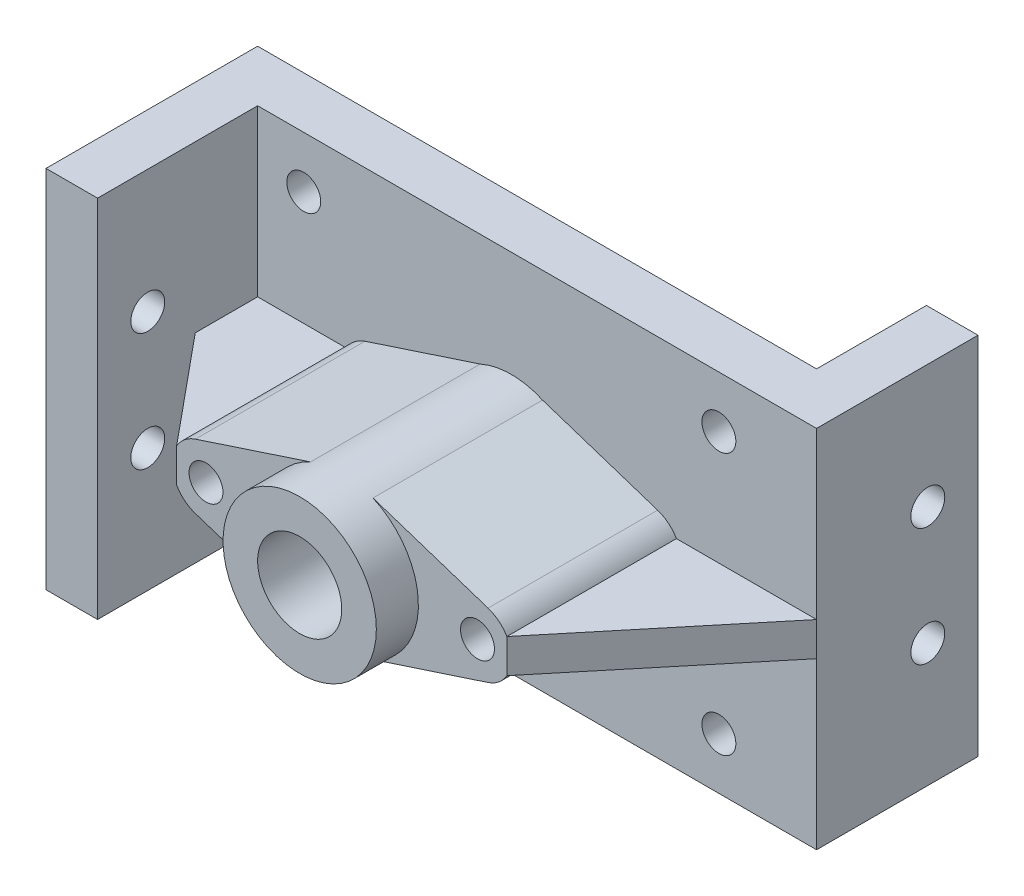
from build123d import *

# Parameters (mm, degrees)
BOSS_EXTRUDE1_DEPTH  = 2.69
SKETCH3_R            = 0.125
CUT_EXTRUDE2_DEPTH   = 10
SKETCH5_R            = 0.125
CUT_EXTRUDE4_DEPTH   = 10
SKETCH2_R            = 0.125
CUT_EXTRUDE5_DEPTH   = 10
SKETCH6_R            = 0.565
BOSS_EXTRUDE2_DEPTH  = 1.56
SKETCH8_R            = 0.31
CUT_EXTRUDE6_DEPTH   = 10
BOSS_EXTRUDE7_DEPTH  = 1.25
SKETCH22_R           = 0.125
CUT_EXTRUDE8_DEPTH   = 10
SKETCH23_R           = 0.125
CUT_EXTRUDE9_DEPTH   = 10
SKETCH25_W           = 1.099767666
SKETCH25_H           = 0.25
BOSS_EXTRUDE8_DEPTH  = 1.25
CUT_EXTRUDE13_DEPTH  = 0.25
SKETCH30_W           = 1.18
SKETCH30_H           = 0.25
BOSS_EXTRUDE10_DEPTH = 0.38


with BuildPart() as part:
    # Sketch1 → Boss-Extrude1 (new body)
    with BuildSketch(Plane(origin=(0, 0, 0), x_dir=(1, 0, 0), z_dir=(0, 1, 0))):
        Polygon((0, 0), (0, 1.56), (4.12, 1.56), (4.12, 2.37), (4.5, 2.37), (4.5, 1.18), (0.38, 1.18), (0.38, 0), align=None)
    extrude(amount=BOSS_EXTRUDE1_DEPTH)

    # Sketch3 → Cut-Extrude2 (cut)
    with BuildSketch(Plane(origin=(4.5, 0, 0), x_dir=(0, 0, -1), z_dir=(1, 0, 0))):
        with Locations((2, 1.78)):
            Circle(SKETCH3_R)
        with Locations(Location((2, 0.91, 0), (0, 0, 180))):
            Circle(SKETCH3_R)
    extrude(amount=-CUT_EXTRUDE2_DEPTH, mode=Mode.SUBTRACT)

    # Sketch5 → Cut-Extrude4 (cut)
    with BuildSketch(Plane(origin=(0.38, 0, 0), x_dir=(0, 0, -1), z_dir=(1, 0, 0))):
        with Locations((0.37, 1.78)):
            Circle(SKETCH5_R)
        with Locations(Location((0.37, 0.91, 0), (0, 0, 180))):
            Circle(SKETCH5_R)
    extrude(amount=-CUT_EXTRUDE4_DEPTH, mode=Mode.SUBTRACT)

    # Sketch2 → Cut-Extrude5 (cut)
    with BuildSketch(Plane.XY.offset(-1.18)):
        with Locations((3.78, 2.31)):
            Circle(SKETCH2_R)
        with Locations(Location((3.78, 0.38, 0), (0, 0, 180))):
            Circle(SKETCH2_R)
        with Locations((0.72, 2.31)):
            Circle(SKETCH2_R)
        with Locations(Location((0.72, 0.38, 0), (0, 0, 180))):
            Circle(SKETCH2_R)
    extrude(amount=-CUT_EXTRUDE5_DEPTH, mode=Mode.SUBTRACT)

    # Sketch6 → Boss-Extrude2 (add)
    with BuildSketch(Plane.XY.offset(-1.18)):
        with Locations(Location((2.25, 1.345, 0), (0, 0, 180))):
            Circle(SKETCH6_R)
    extrude(amount=BOSS_EXTRUDE2_DEPTH)

    # Sketch8 → Cut-Extrude6 (cut)
    with BuildSketch(Plane.XY.offset(0.38)):
        with Locations((2.25, 1.345)):
            Circle(SKETCH8_R)
    extrude(amount=-CUT_EXTRUDE6_DEPTH, mode=Mode.SUBTRACT)

    # Sketch14 → Boss-Extrude7 (add)
    with BuildSketch(Plane.XY.offset(-1.18)):
        with BuildLine():
            Line((3.328608678, 1.582320566), (2.480315468, 1.860926143))
            ThreePointArc((2.480315468, 1.860926143), (2.724000654, 1.652487204), (2.815, 1.345))
            ThreePointArc((2.815, 1.345), (2.725283564, 1.039499535), (2.484626428, 0.831020001))
            Line((2.484626428, 0.831020001), (3.328373597, 1.107207799))
            ThreePointArc((3.328373597, 1.107207799), (3.500600483, 1.344679025), (3.328608678, 1.582320566))
        make_face()
    boss_extrude7 = extrude(amount=BOSS_EXTRUDE7_DEPTH)

    # Mirror2: Boss-Extrude7 across plane
    add(boss_extrude7.mirror(Plane.ZY.offset(-2.25)))

    # Sketch22 → Cut-Extrude8 (cut)
    with BuildSketch(Plane.XY.offset(0.07)):
        with Locations((3.250600514, 1.344802722)):
            Circle(SKETCH22_R)
    extrude(amount=-CUT_EXTRUDE8_DEPTH, mode=Mode.SUBTRACT)

    # Sketch23 → Cut-Extrude9 (cut)
    with BuildSketch(Plane.XY.offset(0.07)):
        with Locations((1.249399486, 1.344802722)):
            Circle(SKETCH23_R)
    extrude(amount=-CUT_EXTRUDE9_DEPTH, mode=Mode.SUBTRACT)

    # Sketch25 → Boss-Extrude8 (add)
    with BuildSketch(Plane.XY.offset(-1.18)):
        with Locations((3.950116167, 1.345)):
            Rectangle(SKETCH25_W, SKETCH25_H)
    boss_extrude8 = extrude(amount=BOSS_EXTRUDE8_DEPTH)

    # Mirror3: Boss-Extrude8 across plane
    add(boss_extrude8.mirror(Plane.ZY.offset(-2.25)))

    # Sketch27 → Cut-Extrude13 (cut)
    with BuildSketch(Plane(origin=(0, 1.47, 0), x_dir=(1, 0, 0), z_dir=(0, 1, 0))):
        Polygon((3.466992847, -0.07), (4.5, 1.18), (4.5, -0.07), align=None)
    cut_extrude13 = extrude(amount=-CUT_EXTRUDE13_DEPTH, mode=Mode.SUBTRACT)

    # Mirror4: Cut-Extrude13 across plane
    add(cut_extrude13.mirror(Plane.ZY.offset(-2.25)), mode=Mode.SUBTRACT)

    # Sketch30 → Boss-Extrude10 (add)
    with BuildSketch(Plane.ZY):
        with Locations((-0.59, 1.345)):
            Rectangle(SKETCH30_W, SKETCH30_H)
    extrude(amount=-BOSS_EXTRUDE10_DEPTH)


solid = part.part
